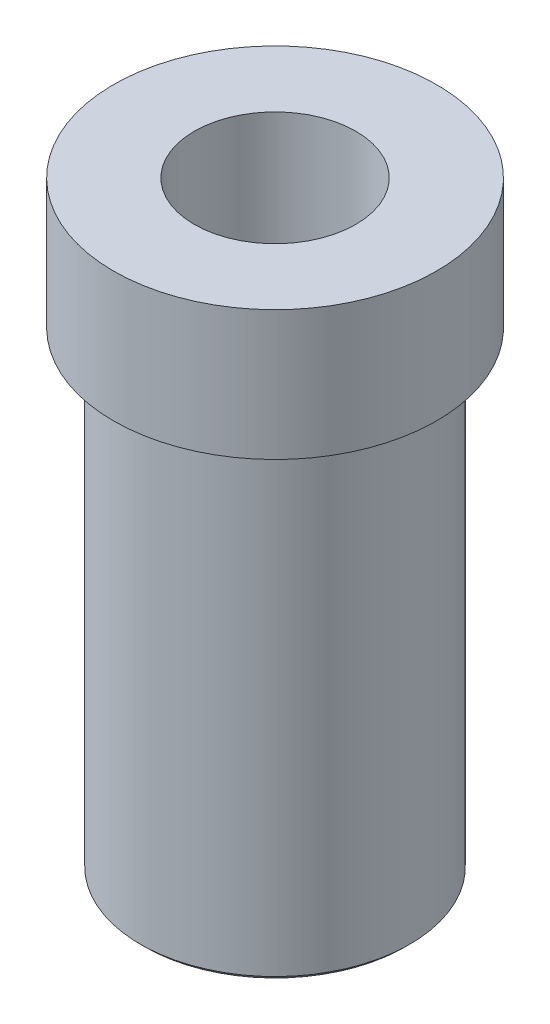
from build123d import *

# Parameters (mm, degrees)
BOSS_EXTRUDE1_DEPTH      = 3.571875
BOSS_EXTRUDE1_DEPTH_BACK = 0.254
SKETCH1_R                = 4.7625
SKETCH2_R                = 3.96875
BOSS_EXTRUDE2_DEPTH      = 13.890625
SKETCH3_R                = 2.38125
CUT_EXTRUDE1_DEPTH       = 19.953553354
CHAMFER1_SIZE            = 0.127


with BuildPart() as part:
    # Sketch1 → Boss-Extrude1 (new, two sides: drawn at the far end of the back side and taken through both)
    with BuildSketch(Plane(origin=(0, 0, 0), x_dir=(1, 0, 0), z_dir=(0, 1, 0)).offset(-BOSS_EXTRUDE1_DEPTH_BACK)):
        with Locations(Location((0, 0, 0), (0, 0, 270))):
            Circle(SKETCH1_R)
    extrude(amount=BOSS_EXTRUDE1_DEPTH + BOSS_EXTRUDE1_DEPTH_BACK)

    # Sketch2 → Boss-Extrude2 (add)
    with BuildSketch(Plane.XZ.offset(0.254)):
        with Locations(Location((0, 0, 0), (0, 0, 270))):
            Circle(SKETCH2_R)
    extrude(amount=BOSS_EXTRUDE2_DEPTH)

    # Sketch3 → Cut-Extrude1 (cut, through all)
    with BuildSketch(Plane.XZ.offset(14.144625)):
        with Locations(Location((0, 0, 0), (0, 0, 270))):
            Circle(SKETCH3_R)
    extrude(amount=-CUT_EXTRUDE1_DEPTH, mode=Mode.SUBTRACT)

    # Chamfer1
    chamfer1_edges = [part.edges().sort_by_distance(p)[0] for p in [
        (0, -14.144625, 3.96875),
    ]]
    chamfer(chamfer1_edges, length=CHAMFER1_SIZE)


solid = part.part
